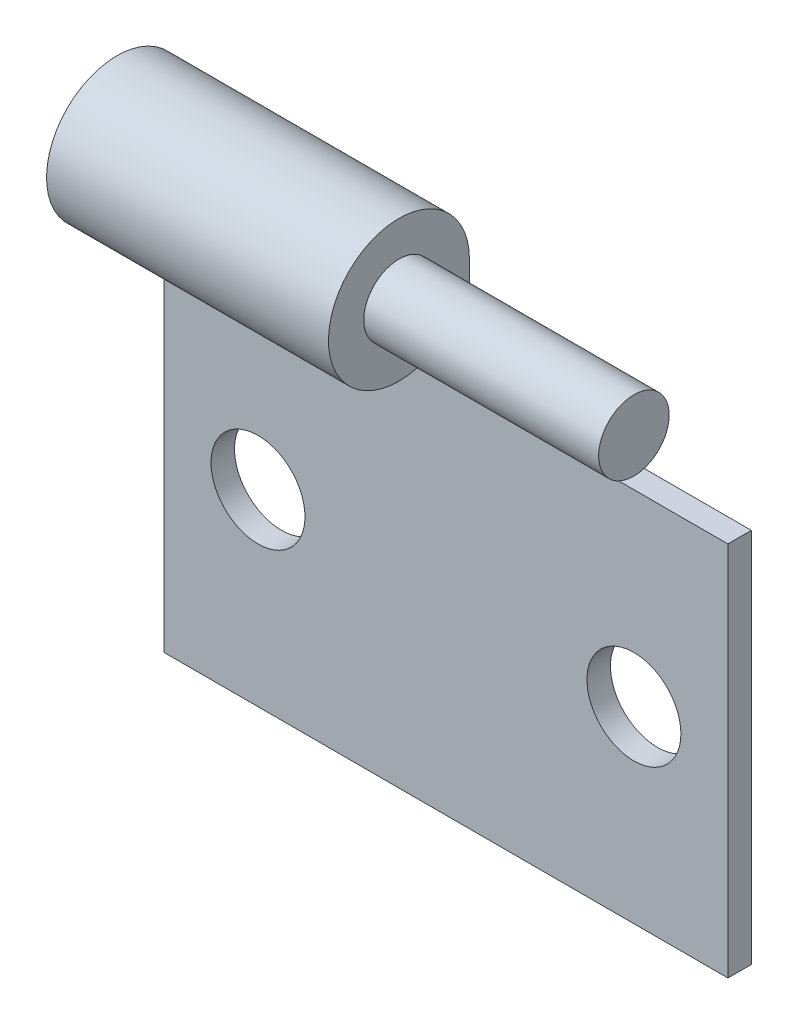
from build123d import *

# Parameters (mm, degrees)
SKETCH1_W           = 76.2
SKETCH1_H           = 50.8
SKETCH1_R           = 6.35
BOSS_EXTRUDE1_DEPTH = 3.175
BOSS_EXTRUDE2_DEPTH = 38.1
FILLET1_R           = 3.175
SKETCH3_2_R         = 4.7625
BOSS_EXTRUDE3_DEPTH = 31.75


with BuildPart() as part:
    # Sketch1 → Boss-Extrude1 (new body)
    with BuildSketch(Plane.XY):
        Rectangle(SKETCH1_W, SKETCH1_H)
        with Locations((-25.4, 0)):
            Circle(SKETCH1_R, mode=Mode.SUBTRACT)
        with Locations((25.4, 0)):
            Circle(SKETCH1_R, mode=Mode.SUBTRACT)
    extrude(amount=BOSS_EXTRUDE1_DEPTH)

    # Sketch2 → Boss-Extrude2 (add)
    with BuildSketch(Plane(origin=(0, 0, 0), x_dir=(0, 0, -1), z_dir=(1, 0, 0))):
        with BuildLine():
            Line((0, 38.1), (0, 25.4))
            Line((0, 25.4), (-3.175, 25.4))
            Line((-3.175, 25.4), (-3.175, 31.000484171))
            ThreePointArc((-3.175, 31.000484171), (-18.2200956, 41.988564967), (0, 38.1))
        make_face()
    extrude(amount=-BOSS_EXTRUDE2_DEPTH)

    # Fillet1
    fillet1_edges = [part.edges().sort_by_distance(p)[0] for p in [
        (-19.05, 31.000484171, 3.175),
    ]]
    fillet(fillet1_edges, radius=FILLET1_R)

    # Sketch3<2> → Boss-Extrude3 (add)
    with BuildSketch(Plane(origin=(0, 0, 0), x_dir=(0, 0, -1), z_dir=(1, 0, 0))):
        with Locations((-9.525, 38.1)):
            Circle(SKETCH3_2_R)
    extrude(amount=BOSS_EXTRUDE3_DEPTH)


solid = part.part
